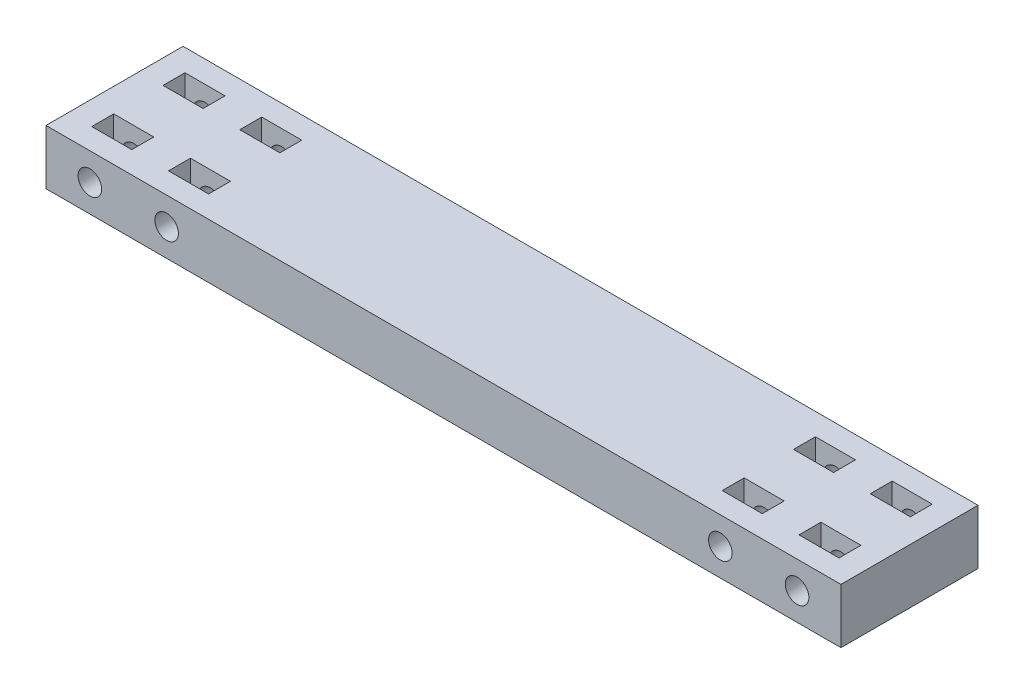
from build123d import *

# Parameters (mm, degrees)
SKETCH1_W           = 145
SKETCH1_H           = 25
BOSS_EXTRUDE1_DEPTH = 10
SKETCH2_R           = 2.15
CUT_EXTRUDE1_DEPTH  = 148.478812038
CUT_EXTRUDE2_REACH  = 149.479
SKETCH3_W           = 7.3
SKETCH3_H           = 4


with BuildPart() as part:
    # Sketch1 → Boss-Extrude1 (new body)
    with BuildSketch(Plane(origin=(0, 0, 0), x_dir=(1, 0, 0), z_dir=(0, 1, 0))):
        with Locations((72.5, 12.5)):
            Rectangle(SKETCH1_W, SKETCH1_H)
    extrude(amount=BOSS_EXTRUDE1_DEPTH)

    # Sketch2 → Cut-Extrude1 (cut, through all)
    with BuildSketch(Plane.XY):
        with Locations((22, 5)):
            Circle(SKETCH2_R)
        with Locations((8, 5)):
            Circle(SKETCH2_R)
        with Locations(Location((123, 5, 0), (0, 0, 180))):
            Circle(SKETCH2_R)
        with Locations(Location((137, 5, 0), (0, 0, 180))):
            Circle(SKETCH2_R)
    extrude(amount=-CUT_EXTRUDE1_DEPTH, mode=Mode.SUBTRACT)

    # Sketch3 → Cut-Extrude2 (cut, up to next)
    with BuildSketch(Plane(origin=(0, 10, 0), x_dir=(1, 0, 0), z_dir=(0, 1, 0)), mode=Mode.PRIVATE) as cut_extrude2_sk1:
        with Locations((137, 19)):
            Rectangle(SKETCH3_W, SKETCH3_H)
    cut_extrude2_tool1 = extrude(cut_extrude2_sk1.sketch, amount=-CUT_EXTRUDE2_REACH, mode=Mode.PRIVATE) & part.part
    # Sketch3 → Cut-Extrude2 (cut, up to next)
    with BuildSketch(Plane(origin=(0, 10, 0), x_dir=(1, 0, 0), z_dir=(0, 1, 0)), mode=Mode.PRIVATE) as cut_extrude2_sk2:
        with Locations((137, 6)):
            Rectangle(SKETCH3_W, SKETCH3_H)
    cut_extrude2_tool2 = extrude(cut_extrude2_sk2.sketch, amount=-CUT_EXTRUDE2_REACH, mode=Mode.PRIVATE) & part.part
    # Sketch3 → Cut-Extrude2 (cut, up to next)
    with BuildSketch(Plane(origin=(0, 10, 0), x_dir=(1, 0, 0), z_dir=(0, 1, 0)), mode=Mode.PRIVATE) as cut_extrude2_sk3:
        with Locations((123, 6)):
            Rectangle(SKETCH3_W, SKETCH3_H)
    cut_extrude2_tool3 = extrude(cut_extrude2_sk3.sketch, amount=-CUT_EXTRUDE2_REACH, mode=Mode.PRIVATE) & part.part
    # Sketch3 → Cut-Extrude2 (cut, up to next)
    with BuildSketch(Plane(origin=(0, 10, 0), x_dir=(1, 0, 0), z_dir=(0, 1, 0)), mode=Mode.PRIVATE) as cut_extrude2_sk4:
        with Locations((123, 19)):
            Rectangle(SKETCH3_W, SKETCH3_H)
    cut_extrude2_tool4 = extrude(cut_extrude2_sk4.sketch, amount=-CUT_EXTRUDE2_REACH, mode=Mode.PRIVATE) & part.part
    # Sketch3 → Cut-Extrude2 (cut, up to next)
    with BuildSketch(Plane(origin=(0, 10, 0), x_dir=(1, 0, 0), z_dir=(0, 1, 0)), mode=Mode.PRIVATE) as cut_extrude2_sk5:
        with Locations((22, 19)):
            Rectangle(SKETCH3_W, SKETCH3_H)
    cut_extrude2_tool5 = extrude(cut_extrude2_sk5.sketch, amount=-CUT_EXTRUDE2_REACH, mode=Mode.PRIVATE) & part.part
    # Sketch3 → Cut-Extrude2 (cut, up to next)
    with BuildSketch(Plane(origin=(0, 10, 0), x_dir=(1, 0, 0), z_dir=(0, 1, 0)), mode=Mode.PRIVATE) as cut_extrude2_sk6:
        with Locations((22, 6)):
            Rectangle(SKETCH3_W, SKETCH3_H)
    cut_extrude2_tool6 = extrude(cut_extrude2_sk6.sketch, amount=-CUT_EXTRUDE2_REACH, mode=Mode.PRIVATE) & part.part
    # Sketch3 → Cut-Extrude2 (cut, up to next)
    with BuildSketch(Plane(origin=(0, 10, 0), x_dir=(1, 0, 0), z_dir=(0, 1, 0)), mode=Mode.PRIVATE) as cut_extrude2_sk7:
        with Locations((8, 19)):
            Rectangle(SKETCH3_W, SKETCH3_H)
    cut_extrude2_tool7 = extrude(cut_extrude2_sk7.sketch, amount=-CUT_EXTRUDE2_REACH, mode=Mode.PRIVATE) & part.part
    # Sketch3 → Cut-Extrude2 (cut, up to next)
    with BuildSketch(Plane(origin=(0, 10, 0), x_dir=(1, 0, 0), z_dir=(0, 1, 0)), mode=Mode.PRIVATE) as cut_extrude2_sk8:
        with Locations((8, 6)):
            Rectangle(SKETCH3_W, SKETCH3_H)
    cut_extrude2_tool8 = extrude(cut_extrude2_sk8.sketch, amount=-CUT_EXTRUDE2_REACH, mode=Mode.PRIVATE) & part.part
    add(cut_extrude2_tool1.solids().sort_by_distance((137, 10, -19))[0], mode=Mode.SUBTRACT)
    add(cut_extrude2_tool2.solids().sort_by_distance((137, 10, -6))[0], mode=Mode.SUBTRACT)
    add(cut_extrude2_tool3.solids().sort_by_distance((123, 10, -6))[0], mode=Mode.SUBTRACT)
    add(cut_extrude2_tool4.solids().sort_by_distance((123, 10, -19))[0], mode=Mode.SUBTRACT)
    add(cut_extrude2_tool5.solids().sort_by_distance((22, 10, -19))[0], mode=Mode.SUBTRACT)
    add(cut_extrude2_tool6.solids().sort_by_distance((22, 10, -6))[0], mode=Mode.SUBTRACT)
    add(cut_extrude2_tool7.solids().sort_by_distance((8, 10, -19))[0], mode=Mode.SUBTRACT)
    add(cut_extrude2_tool8.solids().sort_by_distance((8, 10, -6))[0], mode=Mode.SUBTRACT)


solid = part.part
